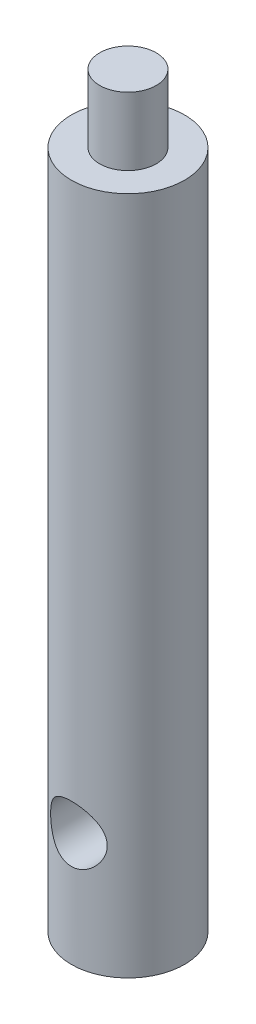
from build123d import *

# Parameters (mm, degrees)
SKETCH2_R          = 2.5
CUT_EXTRUDE1_DEPTH = 10


with BuildPart() as part:
    # Sketch1 → Revolve1 (revolve)
    with BuildSketch(Plane.XY, mode=Mode.PRIVATE) as revolve1_sk:
        Polygon((0, 66), (2.5, 66), (2.5, 60), (5, 60), (5, 0), (0, 0), align=None)
    revolve(revolve1_sk.sketch.rotate(Axis((0, 51.174824137, 0), (0, -1, 0)), 90), axis=Axis((0, 51.174824137, 0), (0, -1, 0)))

    # Sketch2 → Cut-Extrude1 (cut, symmetric)
    with BuildSketch(Plane.XY):
        with Locations((0, 10)):
            Circle(SKETCH2_R)
    extrude(amount=CUT_EXTRUDE1_DEPTH, both=True, mode=Mode.SUBTRACT)


solid = part.part
